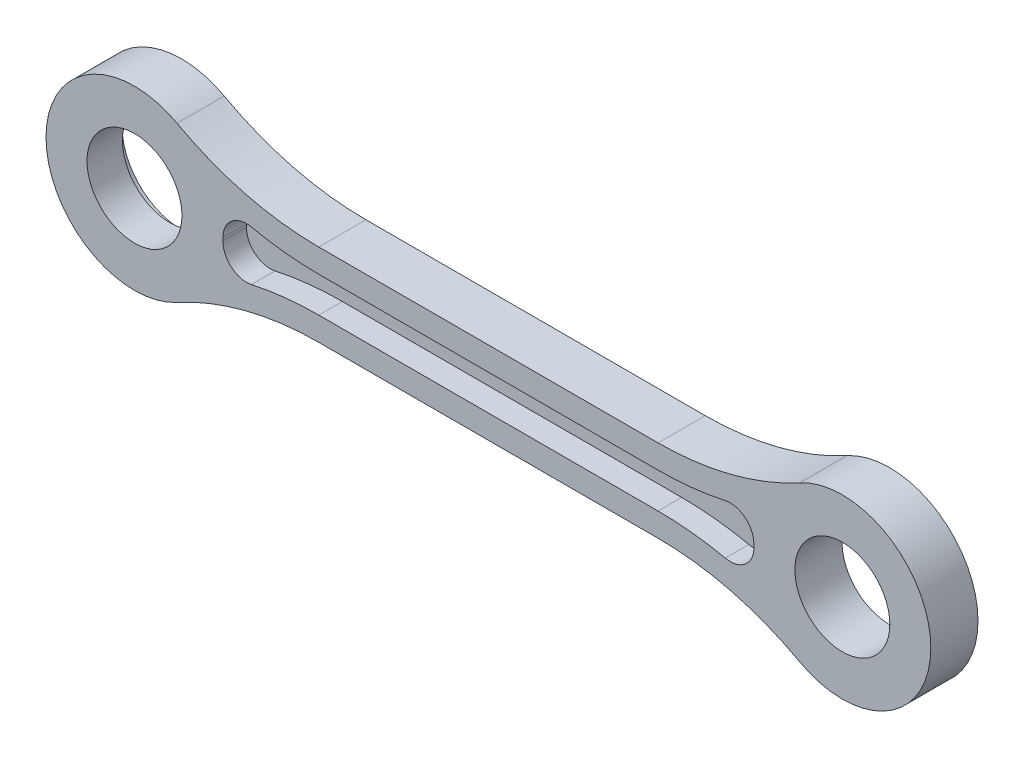
from build123d import *

# Parameters (mm, degrees)
SKETCH_1_R          = 4.025
EXTRUDE_1_DEPTH     = 4
CUT_EXTRUDE_START   = -10
CUT_EXTRUDE_1_DEPTH = 10
SKETCH_4_R          = 5.05
CUT_EXTRUDE_2_DEPTH = 1
CUT_EXTRUDE_START_2 = -2
CUT_EXTRUDE_3_DEPTH = 2
FILLET_2_R          = 2


with BuildPart() as part:
    # 草图1 → 凸台-拉伸1 (new body)
    with BuildSketch(Plane.XY):
        with BuildLine():
            Line((-30, 7.5), (30, 7.5))
            ThreePointArc((30, 7.5), (37.5, 0), (30, -7.5))
            Line((30, -7.5), (-30, -7.5))
            ThreePointArc((-30, -7.5), (-37.5, 0), (-30, 7.5))
        make_face()
        with Locations((-30, 0)):
            Circle(SKETCH_1_R, mode=Mode.SUBTRACT)
        with Locations((30, 0)):
            Circle(SKETCH_1_R, mode=Mode.SUBTRACT)
    extrude(amount=EXTRUDE_1_DEPTH)

    # 草图2 → 切除-拉伸1 (cut)
    with BuildSketch(Plane.XY.offset(4).offset(CUT_EXTRUDE_START)):
        with BuildLine():
            ThreePointArc((-26.39526938, 6.576923077), (-20.581237378, 4.281443859), (-14.379500648, 3.5))
            Line((-14.379500648, 3.5), (14.379500648, 3.5))
            ThreePointArc((14.379500648, 3.5), (20.581237378, 4.281443859), (26.39526938, 6.576923077))
            ThreePointArc((26.39526938, 6.576923077), (28.139478981, 7.265566842), (30, 7.5))
            Line((30, 7.5), (-30, 7.5))
            ThreePointArc((-30, 7.5), (-28.139478981, 7.265566842), (-26.39526938, 6.576923077))
        make_face()
        with BuildLine():
            ThreePointArc((-26.39526938, -6.576923077), (-28.139478981, -7.265566842), (-30, -7.5))
            Line((-30, -7.5), (30, -7.5))
            ThreePointArc((30, -7.5), (28.139478981, -7.265566842), (26.39526938, -6.576923077))
            ThreePointArc((26.39526938, -6.576923077), (20.581237378, -4.281443859), (14.379500648, -3.5))
            Line((14.379500648, -3.5), (-14.379500648, -3.5))
            ThreePointArc((-14.379500648, -3.5), (-20.581237378, -4.281443859), (-26.39526938, -6.576923077))
        make_face()
    extrude(amount=CUT_EXTRUDE_1_DEPTH, mode=Mode.SUBTRACT)

    # 草图4 → 切除-拉伸2 (cut)
    with BuildSketch(Plane(origin=(0, 0, 0), x_dir=(-1, 0, 0), z_dir=(0, 0, -1))):
        with Locations((30, 0)):
            Circle(SKETCH_4_R)
    extrude(amount=-CUT_EXTRUDE_2_DEPTH, mode=Mode.SUBTRACT)

    # 草图5 → 切除-拉伸3 (cut)
    with BuildSketch(Plane.XY.offset(4).offset(CUT_EXTRUDE_START_2)):
        with BuildLine():
            ThreePointArc((-23.103831173, -2.948364888), (-18.801369709, -1.864552303), (-14.379500648, -1.5))
            Line((-14.379500648, -1.5), (14.379500648, -1.5))
            ThreePointArc((14.379500648, -1.5), (18.801369709, -1.864552303), (23.103831173, -2.948364888))
            ThreePointArc((23.103831173, -2.948364888), (22.5, 0), (23.103831173, 2.948364888))
            ThreePointArc((23.103831173, 2.948364888), (18.801369709, 1.864552303), (14.379500648, 1.5))
            Line((14.379500648, 1.5), (-14.379500648, 1.5))
            ThreePointArc((-14.379500648, 1.5), (-18.801369709, 1.864552303), (-23.103831173, 2.948364888))
            ThreePointArc((-23.103831173, 2.948364888), (-22.65250838, 1.504781346), (-22.5, 0))
            ThreePointArc((-22.5, 0), (-22.65250838, -1.504781346), (-23.103831173, -2.948364888))
        make_face()
    extrude(amount=CUT_EXTRUDE_3_DEPTH, mode=Mode.SUBTRACT)

    # 圆角2
    fillet_2_edges = [part.edges().sort_by_distance(p)[0] for p in [
        (23.103831173, 2.948364888, 3),
        (23.103831173, -2.948364888, 3),
        (-23.103831173, -2.948364888, 3),
        (-23.103831173, 2.948364888, 3),
    ]]
    fillet(fillet_2_edges, radius=FILLET_2_R)


solid = part.part
